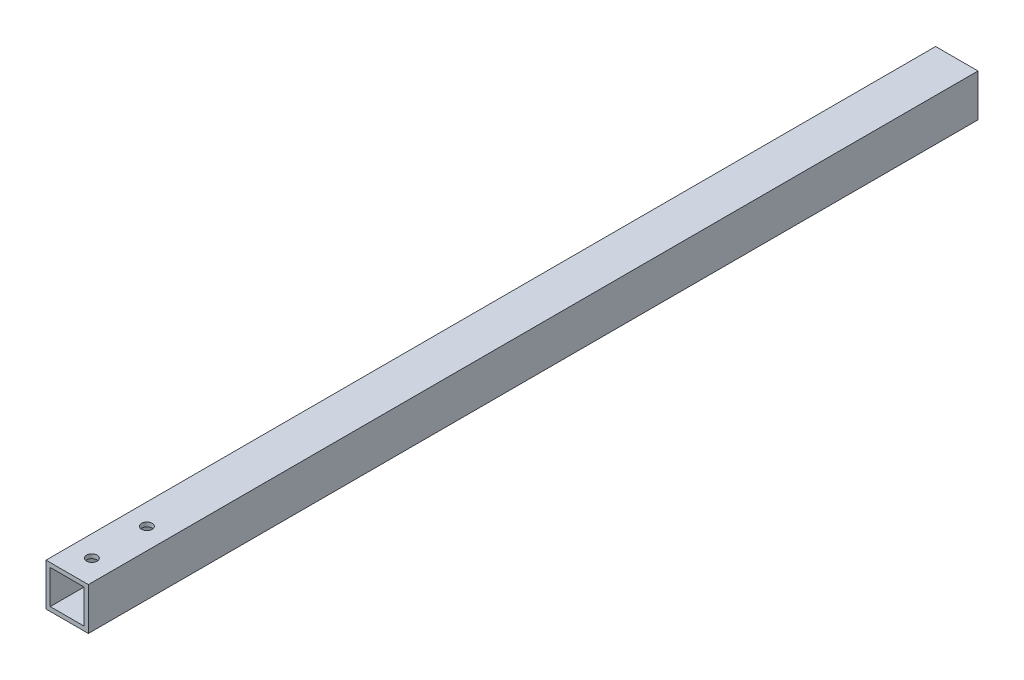
from build123d import *

# Parameters (mm, degrees)
SKETCH_1_W      = 10
SKETCH_1_H      = 10
SKETCH_1_W_2    = 8
SKETCH_1_H_2    = 8
EXTRUDE_1_DEPTH = 210
HOLE_WIZARD_1_D = 2.5


with BuildPart() as part:
    # 草图1 → 凸台-拉伸1 (new body)
    with BuildSketch(Plane.XY):
        Rectangle(SKETCH_1_W, SKETCH_1_H)
        Rectangle(SKETCH_1_W_2, SKETCH_1_H_2, mode=Mode.SUBTRACT)
    extrude(amount=EXTRUDE_1_DEPTH)

    # 孔1 (through all)
    with Locations(Plane(origin=(0, -5, 0), x_dir=(-1, 0, 0), z_dir=(0, -1, 0))):
        with Locations((0, -204.177136039), (0, -191.177136039), (-130, -204.177136039), (-130, -191.177136039)):
            Hole(HOLE_WIZARD_1_D / 2)


solid = part.part
